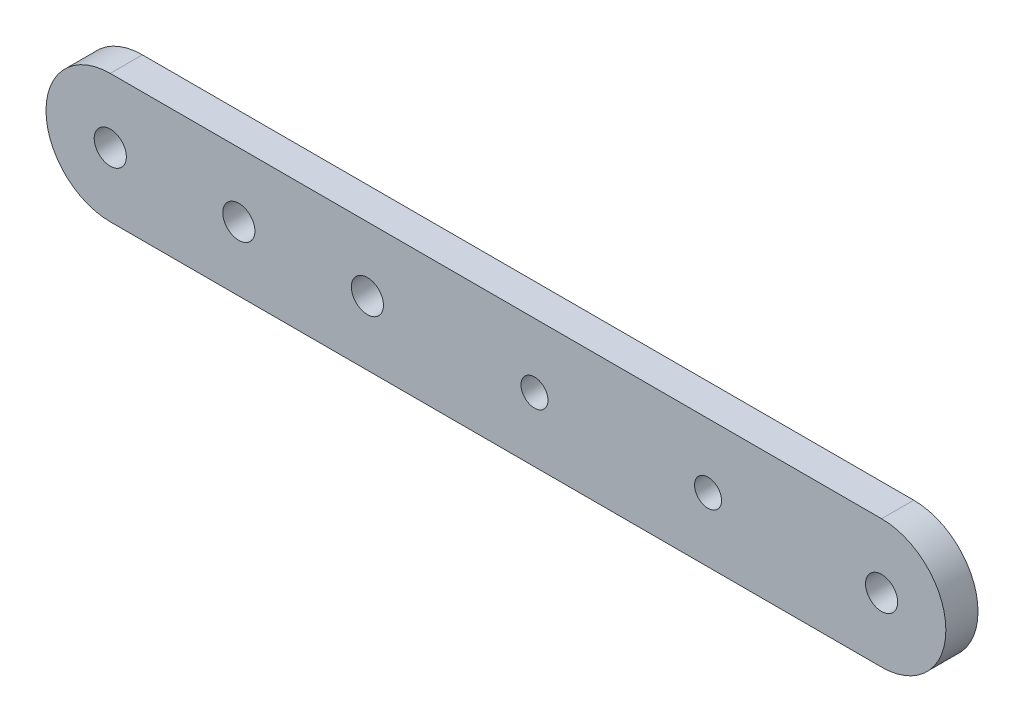
from build123d import *

# Parameters (mm, degrees)
ESQUISSE1_R      = 2.5
ESQUISSE1_R_2    = 2.1
EXTRUSION1_DEPTH = 5


with BuildPart() as part:
    # Esquisse1 → Extrusion1 (new body)
    with BuildSketch(Plane.XY):
        with BuildLine():
            Line((60, 10), (-60, 10))
            ThreePointArc((-60, 10), (-70, 0), (-60, -10))
            Line((-60, -10), (60, -10))
            ThreePointArc((60, -10), (70, 0), (60, 10))
        make_face()
        with Locations((60, 0)):
            Circle(ESQUISSE1_R, mode=Mode.SUBTRACT)
        with Locations((-60, 0)):
            Circle(ESQUISSE1_R, mode=Mode.SUBTRACT)
        with Locations((33, 0)):
            Circle(ESQUISSE1_R_2, mode=Mode.SUBTRACT)
        with Locations((6, 0)):
            Circle(ESQUISSE1_R_2, mode=Mode.SUBTRACT)
        with Locations((-40, 0)):
            Circle(ESQUISSE1_R, mode=Mode.SUBTRACT)
        with Locations((-20, 0)):
            Circle(ESQUISSE1_R, mode=Mode.SUBTRACT)
    extrude(amount=EXTRUSION1_DEPTH)


solid = part.part
